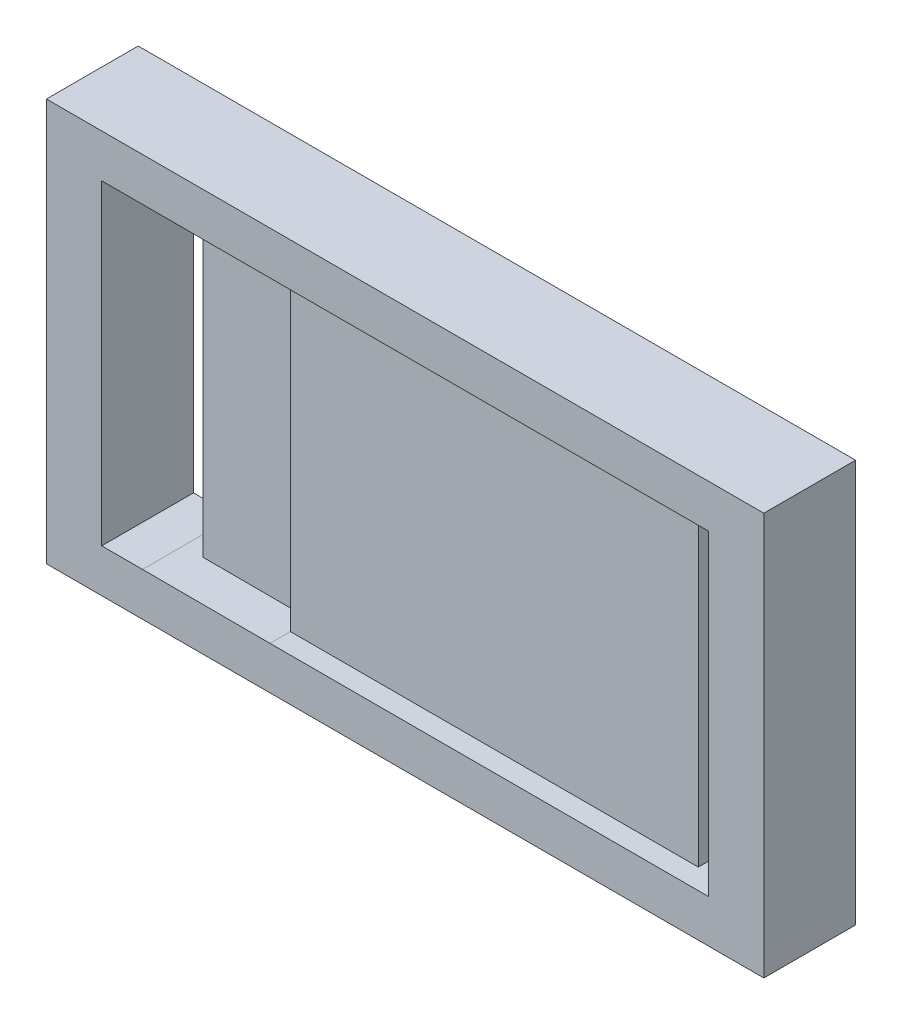
from build123d import *

# Parameters (mm, degrees)
EXTRUDE_1_DEPTH      = 10
EXTRUDE_1_DEPTH_BACK = 8
SKETCH_1_W           = 140.696839698
SKETCH_1_H           = 78.948263704
SKETCH_1_W_2         = 119
SKETCH_1_H_2         = 62
SKETCH_2_W           = 111
SKETCH_2_H           = 62
EXTRUDE_2_DEPTH      = 10
CUT_EXTRUDE_1_DEPTH  = 8
CUT_EXTRUDE_2_DEPTH  = 82.284114443
SKETCH_5_W           = 6
SKETCH_5_H           = 62.061558852
CUT_EXTRUDE_3_DEPTH  = 83.650512768
SKETCH_6_W           = 79.998419849
SKETCH_6_H           = 62.061558852
CUT_EXTRUDE_4_DEPTH  = 4


with BuildPart() as part:
    # 草图1 → 凸台-拉伸1 (new, two sides: drawn at the far end of the back side and taken through both)
    with BuildSketch(Plane.XY.offset(-EXTRUDE_1_DEPTH_BACK)):
        Rectangle(SKETCH_1_W, SKETCH_1_H)
        Rectangle(SKETCH_1_W_2, SKETCH_1_H_2, mode=Mode.SUBTRACT)
    extrude(amount=EXTRUDE_1_DEPTH + EXTRUDE_1_DEPTH_BACK)

    # 草图2 → 凸台-拉伸2 (add)
    with BuildSketch(Plane.XY):
        with Locations((4, 0)):
            Rectangle(SKETCH_2_W, SKETCH_2_H)
    extrude(amount=EXTRUDE_2_DEPTH)

    # 草图3 → 切除-拉伸1 (cut)
    with BuildSketch(Plane.XY.offset(10)):
        Polygon((-51.5, 31), (-26.5, 31), (-26.5, -31.061558852), (-51.5, -31), align=None)
    extrude(amount=-CUT_EXTRUDE_1_DEPTH, mode=Mode.SUBTRACT)

    # 草图4 → 切除-拉伸2 (cut, through all)
    with BuildSketch(Plane.XY.offset(2)):
        Polygon((-51.5, 31), (-47.603613943, 31), (-47.603613943, -31.009594282), (-51.5, -31), align=None)
    extrude(amount=-CUT_EXTRUDE_2_DEPTH, mode=Mode.SUBTRACT)

    # 草图5 → 切除-拉伸3 (cut, through all)
    with BuildSketch(Plane.XY.offset(10)):
        with Locations((56.498419849, -0.030779426)):
            Rectangle(SKETCH_5_W, SKETCH_5_H)
    extrude(amount=-CUT_EXTRUDE_3_DEPTH, mode=Mode.SUBTRACT)

    # 草图6 → 切除-拉伸4 (cut)
    with BuildSketch(Plane.XY.offset(10)):
        with Locations((13.499209925, -0.030779426)):
            Rectangle(SKETCH_6_W, SKETCH_6_H)
    extrude(amount=-CUT_EXTRUDE_4_DEPTH, mode=Mode.SUBTRACT)


solid = part.part
